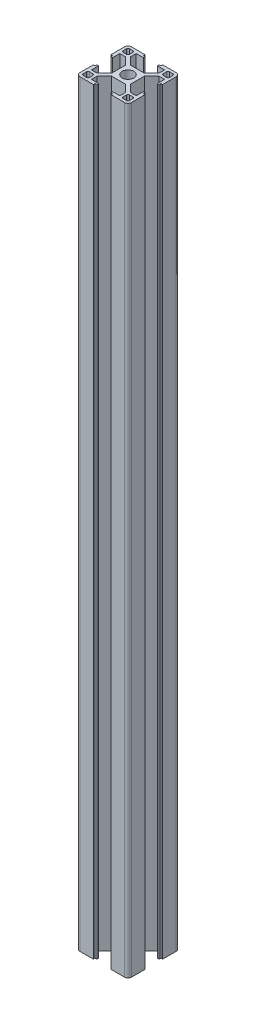
from build123d import *

# Parameters (mm, degrees)
SKETCH1_R           = 3.4
BOSS_EXTRUDE1_DEPTH = 440


with BuildPart() as part:
    # Sketch1 → Boss-Extrude1 (new body)
    with BuildSketch(Plane.XZ):
        with BuildLine():
            Line((-8.24999678, 13.000000511), (-4.100001047, 13.000000511))
            Line((-4.100001047, 13.000000511), (-4.100001047, 13.9999993))
            Line((-4.100001047, 13.9999993), (-5.100001047, 13.9999993))
            Line((-5.100001047, 13.9999993), (-5.100001047, 15.000001161))
            Line((-5.100001047, 15.000001161), (-12.9999991, 15.000001161))
            ThreePointArc((-12.9999991, 15.000001161), (-14.414213082, 14.414214549), (-14.999999693, 13.000000567))
            Line((-14.999999693, 13.000000567), (-14.999999693, 5.099999792))
            Line((-14.999999693, 5.099999792), (-14.000001367, 5.099999792))
            Line((-14.000001367, 5.099999792), (-14.000001367, 4.099999792))
            Line((-14.000001367, 4.099999792), (-12.999980958, 4.099999792))
            Line((-12.999980958, 4.099999792), (-12.999980958, 8.250012005))
            Line((-12.999980958, 8.250012005), (-9.664201657, 8.250012005))
            Line((-9.664201657, 8.250012005), (-5.514202303, 4.100011174))
            Line((-5.514202303, 4.100011174), (-5.514202303, -4.099988826))
            Line((-5.514202303, -4.099988826), (-9.664194622, -8.249987936))
            Line((-9.664194622, -8.249987936), (-12.999980958, -8.249987936))
            Line((-12.999980958, -8.249987936), (-12.999980958, -4.100000208))
            Line((-12.999980958, -4.100000208), (-14.000001367, -4.100000208))
            Line((-14.000001367, -4.100000208), (-14.000001367, -5.100000208))
            Line((-14.000001367, -5.100000208), (-14.999999693, -5.100000208))
            Line((-14.999999693, -5.100000208), (-14.999999693, -13.000000955))
            ThreePointArc((-14.999999693, -13.000000955), (-14.414213128, -14.414214825), (-12.999999257, -15.000001391))
            Line((-12.999999257, -15.000001391), (-5.100001047, -15.000001391))
            Line((-5.100001047, -15.000001391), (-5.100001047, -14.000000699))
            Line((-5.100001047, -14.000000699), (-4.100001047, -14.000000699))
            Line((-4.100001047, -14.000000699), (-4.100001047, -13.000000927))
            Line((-4.100001047, -13.000000927), (-8.24999678, -13.000000927))
            Line((-8.24999678, -13.000000927), (-8.24999678, -9.664217294))
            Line((-8.24999678, -9.664217294), (-4.09999914, -5.514212907))
            Line((-4.09999914, -5.514212907), (4.100018356, -5.514212907))
            Line((4.100018356, -5.514212907), (8.250001062, -9.66419709))
            Line((8.250001062, -9.66419709), (8.250001062, -13.000000927))
            Line((8.250001062, -13.000000927), (4.099987439, -13.000000927))
            Line((4.099987439, -13.000000927), (4.099987439, -14.000000699))
            Line((4.099987439, -14.000000699), (5.099987459, -14.000000699))
            Line((5.099987459, -14.000000699), (5.099987459, -15.000001391))
            Line((5.099987459, -15.000001391), (12.999985682, -15.000001391))
            ThreePointArc((12.999985682, -15.000001391), (14.414199699, -14.414214765), (14.999986325, -13.000000748))
            Line((14.999986325, -13.000000748), (14.999986325, -5.100000208))
            Line((14.999986325, -5.100000208), (13.999990764, -5.100000208))
            Line((13.999990764, -5.100000208), (13.999990764, -4.100000208))
            Line((13.999990764, -4.100000208), (12.999996372, -4.100000208))
            Line((12.999996372, -4.100000208), (12.999996372, -8.249987936))
            Line((12.999996372, -8.249987936), (9.664201659, -8.249987936))
            Line((9.664201659, -8.249987936), (5.514206692, -4.099991492))
            Line((5.514206692, -4.099991492), (5.514206692, 4.100008559))
            Line((5.514206692, 4.100008559), (9.66420339, 8.250012005))
            Line((9.66420339, 8.250012005), (12.999996372, 8.250012005))
            Line((12.999996372, 8.250012005), (12.999996372, 4.099999792))
            Line((12.999996372, 4.099999792), (13.999990764, 4.099999792))
            Line((13.999990764, 4.099999792), (13.999990764, 5.099999792))
            Line((13.999990764, 5.099999792), (14.999986325, 5.099999792))
            Line((14.999986325, 5.099999792), (14.999986325, 13.000001058))
            ThreePointArc((14.999986325, 13.000001058), (14.414199857, 14.414214693), (12.999986222, 15.000001161))
            Line((12.999986222, 15.000001161), (5.099987459, 15.000001161))
            Line((5.099987459, 15.000001161), (5.099987459, 13.9999993))
            Line((5.099987459, 13.9999993), (4.099987439, 13.9999993))
            Line((4.099987439, 13.9999993), (4.099987439, 13.000000511))
            Line((4.099987439, 13.000000511), (8.250001062, 13.000000511))
            Line((8.250001062, 13.000000511), (8.250001062, 9.664237062))
            Line((8.250001062, 9.664237062), (4.100007893, 5.514237102))
            Line((4.100007893, 5.514237102), (-4.100018481, 5.514237102))
            Line((-4.100018481, 5.514237102), (-8.24999678, 9.664216878))
            Line((-8.24999678, 9.664216878), (-8.24999678, 13.000000511))
        make_face()
        with Locations(Location((-1.0477e-05, -4.16e-07, 0), (0, 0, 90))):
            Circle(SKETCH1_R, mode=Mode.SUBTRACT)
        with BuildLine():
            Line((13.499986967, -10.750000579), (13.499986967, -12.500001267))
            ThreePointArc((13.499986967, -12.500001267), (13.207093572, -13.207108473), (12.499986367, -13.500001867))
            Line((12.499986367, -13.500001867), (10.749986886, -13.500001867))
            ThreePointArc((10.749986886, -13.500001867), (10.042879512, -13.207108403), (9.749986047, -12.500001028))
            Line((9.749986047, -12.500001028), (9.749986047, -10.750001028))
            ThreePointArc((9.749986047, -10.750001028), (10.042879305, -10.042894153), (10.74998618, -9.750000895))
            Line((10.74998618, -9.750000895), (12.499987283, -9.750000895))
            ThreePointArc((12.499987283, -9.750000895), (13.207093841, -10.042894021), (13.499986967, -10.750000579))
        make_face(mode=Mode.SUBTRACT)
        with BuildLine():
            Line((-10.749994869, 9.750000545), (-12.499998542, 9.750000545))
            ThreePointArc((-12.499998542, 9.750000545), (-13.207105378, 10.042893787), (-13.499998619, 10.750000623))
            Line((-13.499998619, 10.750000623), (-13.499998619, 12.500000623))
            ThreePointArc((-13.499998619, 12.500000623), (-13.207105152, 13.207108005), (-12.499997769, 13.500001473))
            Line((-12.499997769, 13.500001473), (-10.749995653, 13.500001473))
            ThreePointArc((-10.749995653, 13.500001473), (-10.04288827, 13.207108005), (-9.749994803, 12.500000623))
            Line((-9.749994803, 12.500000623), (-9.749994803, 10.750000612))
            ThreePointArc((-9.749994803, 10.750000612), (-10.042888041, 10.042893784), (-10.749994869, 9.750000545))
        make_face(mode=Mode.SUBTRACT)
        with BuildLine():
            Line((12.499988487, 9.750000545), (10.74998617, 9.750000545))
            ThreePointArc((10.74998617, 9.750000545), (10.042879302, 10.0428938), (9.749986047, 10.750000668))
            Line((9.749986047, 10.750000668), (9.749986047, 12.500000634))
            ThreePointArc((9.749986047, 12.500000634), (10.042879552, 13.207108106), (10.749987025, 13.500001611))
            Line((10.749987025, 13.500001611), (12.499987646, 13.500001611))
            ThreePointArc((12.499987646, 13.500001611), (13.207095116, 13.207108107), (13.49998862, 12.500000637))
            Line((13.49998862, 12.500000637), (13.49998862, 10.750000679))
            ThreePointArc((13.49998862, 10.750000679), (13.207095362, 10.042893803), (12.499988487, 9.750000545))
        make_face(mode=Mode.SUBTRACT)
        with BuildLine():
            Line((-10.749995791, -13.500002028), (-12.499997631, -13.500002028))
            ThreePointArc((-12.499997631, -13.500002028), (-13.207105111, -13.207108519), (-13.499998619, -12.500001039))
            Line((-13.499998619, -12.500001039), (-13.499998619, -10.750001039))
            ThreePointArc((-13.499998619, -10.750001039), (-13.207105358, -10.042894156), (-12.499998475, -9.750000895))
            Line((-12.499998475, -9.750000895), (-10.749994936, -9.750000895))
            ThreePointArc((-10.749994936, -9.750000895), (-10.042888061, -10.042894153), (-9.749994803, -10.750001028))
            Line((-9.749994803, -10.750001028), (-9.749994803, -12.500001039))
            ThreePointArc((-9.749994803, -12.500001039), (-10.042888311, -13.207108519), (-10.749995791, -13.500002028))
        make_face(mode=Mode.SUBTRACT)
    extrude(amount=-BOSS_EXTRUDE1_DEPTH)


solid = part.part
